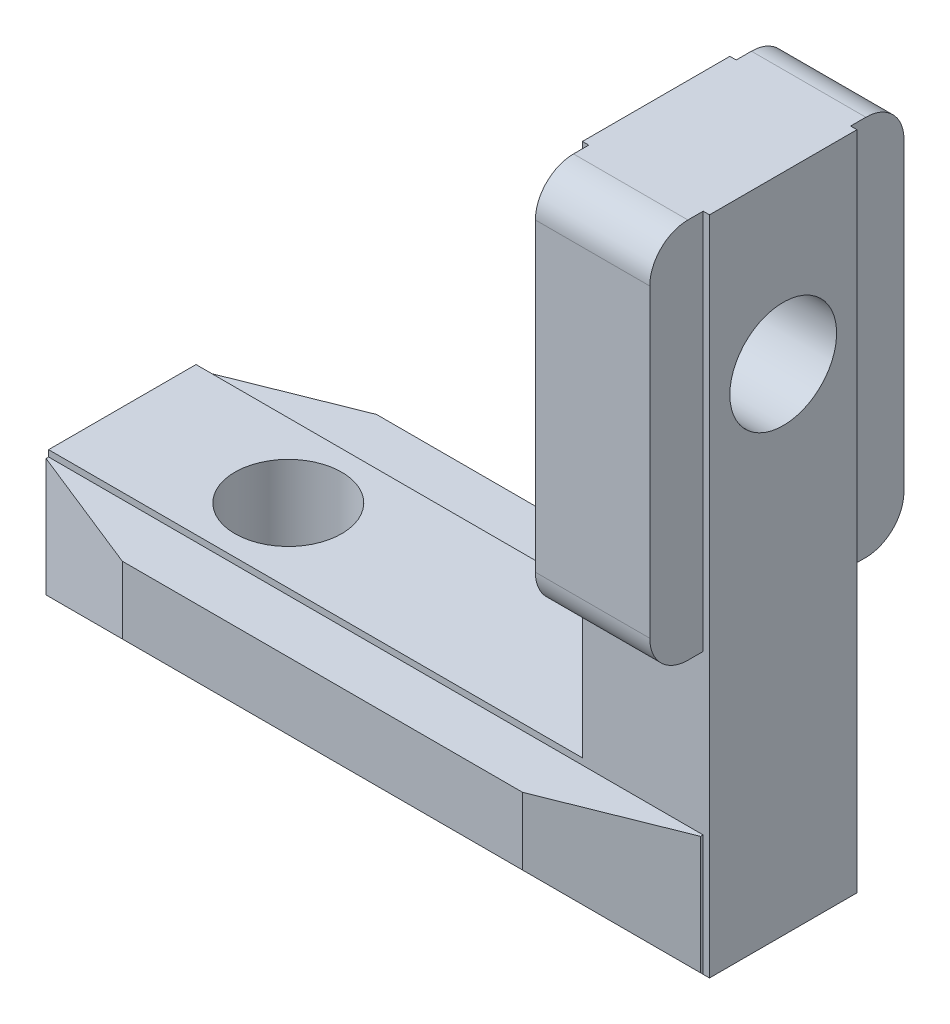
from build123d import *

# Parameters (mm, degrees)
EXTRUDE_1_DEPTH   = 2.9
EXTRUDE_2_DEPTH   = 25.75
EXTRUDE_2_2_DEPTH = 25.75
CHAMFER_1_SIZE    = 5
CHAMFER_1_SIZE2   = 2
CHAMFER_2_SIZE    = 5
CHAMFER_2_SIZE2   = 2
CHAMFER_3_SIZE    = 2
CHAMFER_3_SIZE2   = 5
CHAMFER_4_SIZE    = 2
CHAMFER_4_SIZE2   = 5
EXTRUDE_3_DEPTH   = 2.25


with BuildPart() as part:
    # 草图1 → 凸台-拉伸1 (new, symmetric)
    with BuildSketch(Plane.XY):
        Polygon((-26, 0), (0, 0), (0, 26), (-5, 26), (-5, 5), (-26, 5), align=None)
    extrude(amount=EXTRUDE_1_DEPTH, both=True)

    # 草图4 → 凸台-拉伸3 (add, symmetric)
    with BuildSketch(Plane.ZY.offset(2.5)):
        with BuildLine():
            Line((-2.9, 11), (-3.5, 11))
            ThreePointArc((-3.5, 11), (-4.560660172, 11.439339828), (-5, 12.5))
            Line((-5, 12.5), (-5, 24.5))
            ThreePointArc((-5, 24.5), (-4.560660172, 25.560660172), (-3.5, 26))
            Line((-3.5, 26), (-2.9, 26))
            Line((-2.9, 26), (-2.9, 11))
        make_face()
        with BuildLine():
            Line((2.9, 26), (2.9, 11))
            Line((2.9, 11), (3.5, 11))
            ThreePointArc((3.5, 11), (4.560660172, 11.439339828), (5, 12.5))
            Line((5, 12.5), (5, 24.5))
            ThreePointArc((5, 24.5), (4.560660172, 25.560660172), (3.5, 26))
            Line((3.5, 26), (2.9, 26))
        make_face()
    extrude(amount=EXTRUDE_3_DEPTH, both=True)

    # 草图6 → M5 螺纹孔1 (revolve, cut)
    with BuildSketch(Plane(origin=(-19.47, 5, 0), x_dir=(0, 0, 1), z_dir=(1, 0, 0))):
        Polygon((0, 0), (0, 28.6618073), (2.1, 27.4), (2.1, 0), align=None)
    hole_wizard_m5_1 = revolve(axis=Axis((-19.47, 11.35, 0), (0, -1, 0)), mode=Mode.SUBTRACT)

    # 镜向1: M5 螺纹孔1 across plane
    add(hole_wizard_m5_1.mirror(Plane(origin=(0, 0, 0), x_dir=(0, 0, 1), z_dir=(-0.7071067811865477, -0.7071067811865475, 0))), mode=Mode.SUBTRACT)


with BuildPart() as body_2:
    # 草图3 → 凸台-拉伸2 (new body)
    with BuildSketch(Plane.ZY.offset(26)):
        Polygon((-2.9, 0), (-5, 2.1), (-5, 4.75), (-2.9, 4.75), align=None)
    extrude(amount=-EXTRUDE_2_DEPTH)

    # 倒角1
    chamfer_1_edges = [body_2.edges().sort_by_distance(p)[0] for p in [
        (-26, 3.425, -5),
    ]]
    chamfer_1_side = [body_2.faces().sort_by_distance(p)[0] for p in [
        (-13.125, 3.425, -5),
    ]]
    chamfer(chamfer_1_edges, length=CHAMFER_1_SIZE, length2=CHAMFER_1_SIZE2, reference=chamfer_1_side[0])

    # 倒角4
    chamfer_4_edges = [body_2.edges().sort_by_distance(p)[0] for p in [
        (-0.25, 3.425, -5),
    ]]
    chamfer_4_side = [body_2.faces().sort_by_distance(p)[0] for p in [
        (-0.25, 2.850337838, -3.850675676),
    ]]
    chamfer(chamfer_4_edges, length=CHAMFER_4_SIZE, length2=CHAMFER_4_SIZE2, reference=chamfer_4_side[0])


with BuildPart() as body_3:
    # 草图3 → Extrude 2 2 (new body)
    with BuildSketch(Plane.ZY.offset(26)):
        Polygon((2.9, 4.75), (2.9, 0), (5, 2.1), (5, 4.75), align=None)
    extrude(amount=-EXTRUDE_2_2_DEPTH)

    # 倒角2
    chamfer_2_edges = [body_3.edges().sort_by_distance(p)[0] for p in [
        (-26, 3.425, 5),
    ]]
    chamfer_2_side = [body_3.faces().sort_by_distance(p)[0] for p in [
        (-13.125, 3.425, 5),
    ]]
    chamfer(chamfer_2_edges, length=CHAMFER_2_SIZE, length2=CHAMFER_2_SIZE2, reference=chamfer_2_side[0])

    # 倒角3
    chamfer_3_edges = [body_3.edges().sort_by_distance(p)[0] for p in [
        (-0.25, 3.425, 5),
    ]]
    chamfer_3_side = [body_3.faces().sort_by_distance(p)[0] for p in [
        (-0.25, 2.850337838, 3.850675676),
    ]]
    chamfer(chamfer_3_edges, length=CHAMFER_3_SIZE, length2=CHAMFER_3_SIZE2, reference=chamfer_3_side[0])


solid = Compound([part.part, body_2.part, body_3.part])
